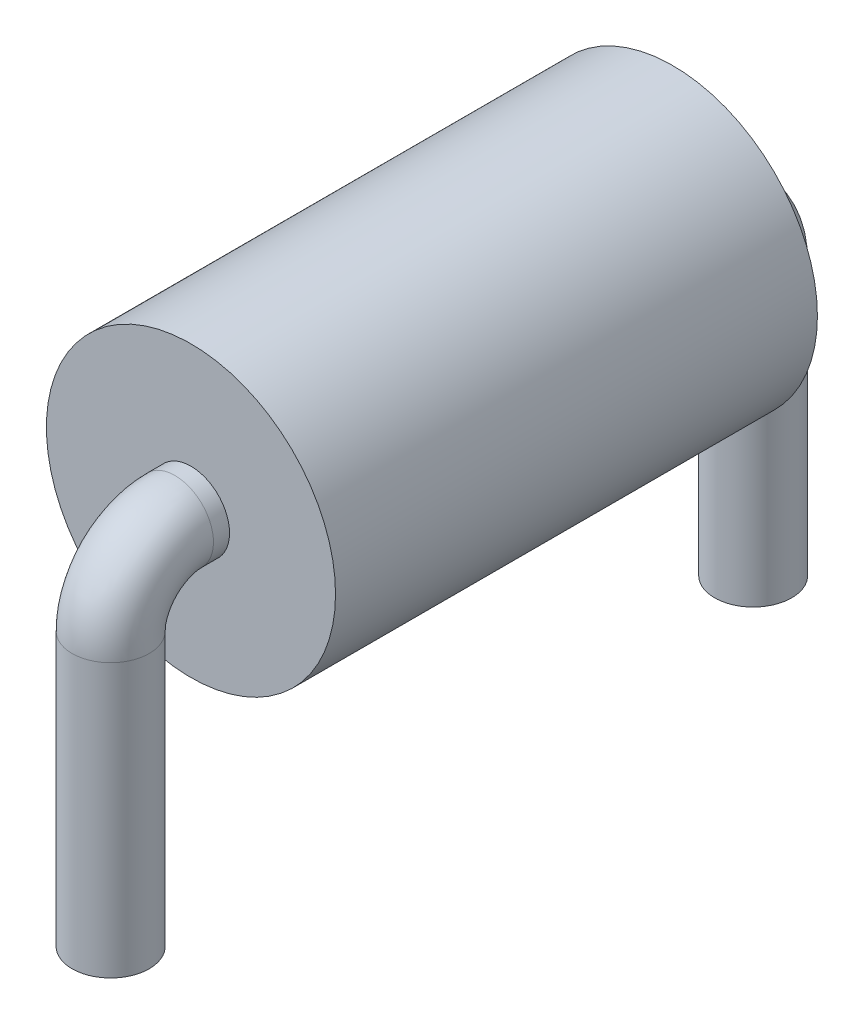
from build123d import *

# Parameters (mm, degrees)
SKETCH_1_R        = 2.25
EXTRUDE_1_DEPTH   = 3.75
SKETCH_4_R        = 0.6
EXTRUDE_2_DEPTH   = 3
EXTRUDE_2_2_DEPTH = 3
SKETCH_2_R        = 0.6
SKETCH_7_R        = 0.6


with BuildPart() as part:
    # Эскиз1 → Бобышка-Вытянуть1 (new, symmetric)
    with BuildSketch(Plane.XY):
        Circle(SKETCH_1_R)
    extrude(amount=EXTRUDE_1_DEPTH, both=True)



with BuildPart() as body_2:
    # Эскиз4 → Бобышка-Вытянуть2 (new body)
    with BuildSketch(Plane(origin=(0, -2.25, 0), x_dir=(-1, 0, 0), z_dir=(0, -1, 0))):
        with Locations(Location((0, -5, 0), (0, 0, 90))):
            Circle(SKETCH_4_R)
    extrude(amount=EXTRUDE_2_DEPTH)


with BuildPart() as body_3:
    # Эскиз4 → Extrude 2 2 (new body)
    with BuildSketch(Plane(origin=(0, -2.25, 0), x_dir=(-1, 0, 0), z_dir=(0, -1, 0))):
        with Locations(Location((0, 5, 0), (0, 0, 90))):
            Circle(SKETCH_4_R)
    extrude(amount=EXTRUDE_2_2_DEPTH)


with BuildPart() as part_1:
    add(part.part)

    add(body_2.part)  # По траектории2 merges body 2
    # По траектории2: sweep along a path in Эскиз5
    with BuildLine(Plane(origin=(0, 0, 0), x_dir=(0, 0, -1), z_dir=(1, 0, 0))) as sweep_2_path:
        Line((-3.75, 0), (-4, 0))
        ThreePointArc((-4, 0), (-4.707106781, -0.292893219), (-5, -1))
        Line((-5, -1), (-5, -3.422153909))
    # Эскиз2 → По траектории2 (sweep)
    with BuildSketch(Plane.XY.offset(3.75)):
        Circle(SKETCH_2_R)
    sweep(path=sweep_2_path.line)


    add(body_3.part)  # По траектории3 merges body 3
    # По траектории3: sweep along a path in Эскиз6
    with BuildLine(Plane(origin=(0, 0, 0), x_dir=(0, 0, -1), z_dir=(1, 0, 0))) as sweep_3_path:
        Line((3.75, 0), (4, 0))
        ThreePointArc((4, 0), (4.707106781, -0.292893219), (5, -1))
        Line((5, -1), (5, -3.141146962))
    # Эскиз7 → По траектории3 (sweep)
    with BuildSketch(Plane(origin=(0, 0, -3.75), x_dir=(-1, 0, 0), z_dir=(0, 0, -1))):
        Circle(SKETCH_7_R)
    sweep(path=sweep_3_path.line)


solid = part_1.part
